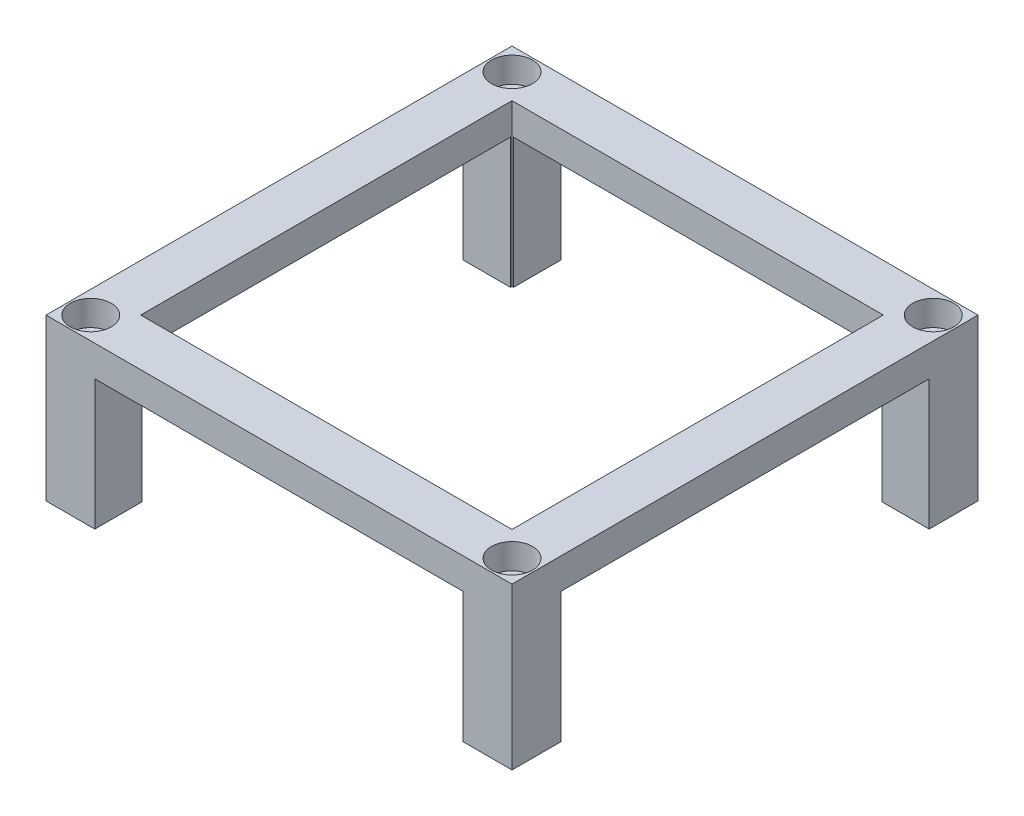
from build123d import *

# Parameters (mm, degrees)
SKETCH1_W                 = 125
SKETCH1_H                 = 125
EXTRUDE1_DEPTH            = 43.18
SKETCH2_W                 = 99.6
SKETCH2_H                 = 99.6
CUT_EXTRUDE1_DEPTH        = 182.973933298
SKETCH3_W                 = 98.8148352
SKETCH3_H                 = 34.925
CUT_EXTRUDE2_DEPTH        = 182.973933298
SKETCH6_W                 = 98.8148352
SKETCH6_H                 = 34.925
CUT_EXTRUDE3_DEPTH        = 182.973933298
HOLE_WIZARD_2_D           = 6.6
HOLE_WIZARD_2_CBORE_D     = 11
HOLE_WIZARD_2_CBORE_DEPTH = 6.8


with BuildPart() as part:
    # Sketch1 → Extrude1 (new body)
    with BuildSketch(Plane(origin=(0, 0, 0), x_dir=(1, 0, 0), z_dir=(0, 1, 0))):
        with Locations((62.5, 62.5)):
            Rectangle(SKETCH1_W, SKETCH1_H)
    extrude(amount=EXTRUDE1_DEPTH)

    # Sketch2 → Cut-Extrude1 (cut, through all)
    with BuildSketch(Plane(origin=(0, 43.18, 0), x_dir=(-1, 0, 0), z_dir=(0, 1, 0))):
        with Locations((-62.5, -62.5)):
            Rectangle(SKETCH2_W, SKETCH2_H)
    extrude(amount=-CUT_EXTRUDE1_DEPTH, mode=Mode.SUBTRACT)

    # Sketch3 → Cut-Extrude2 (cut, through all)
    with BuildSketch(Plane.XY):
        with Locations((62.5, 17.4625)):
            Rectangle(SKETCH3_W, SKETCH3_H)
    extrude(amount=-CUT_EXTRUDE2_DEPTH, mode=Mode.SUBTRACT)

    # Sketch6 → Cut-Extrude3 (cut, through all)
    with BuildSketch(Plane(origin=(125, 0, 0), x_dir=(0, 0, -1), z_dir=(1, 0, 0))):
        with Locations((62.5, 17.4625)):
            Rectangle(SKETCH6_W, SKETCH6_H)
    extrude(amount=-CUT_EXTRUDE3_DEPTH, mode=Mode.SUBTRACT)

    # 打孔尺寸(%根据)内六角圆柱头螺钉的类型2 (through all)
    with Locations(Plane(origin=(0, 43.18, 0), x_dir=(-1, 0, 0), z_dir=(0, 1, 0))):
        with Locations((-6, -6), (-119, -6), (-119, -119), (-6, -119)):
            CounterBoreHole(HOLE_WIZARD_2_D / 2, HOLE_WIZARD_2_CBORE_D / 2, HOLE_WIZARD_2_CBORE_DEPTH)


solid = part.part
